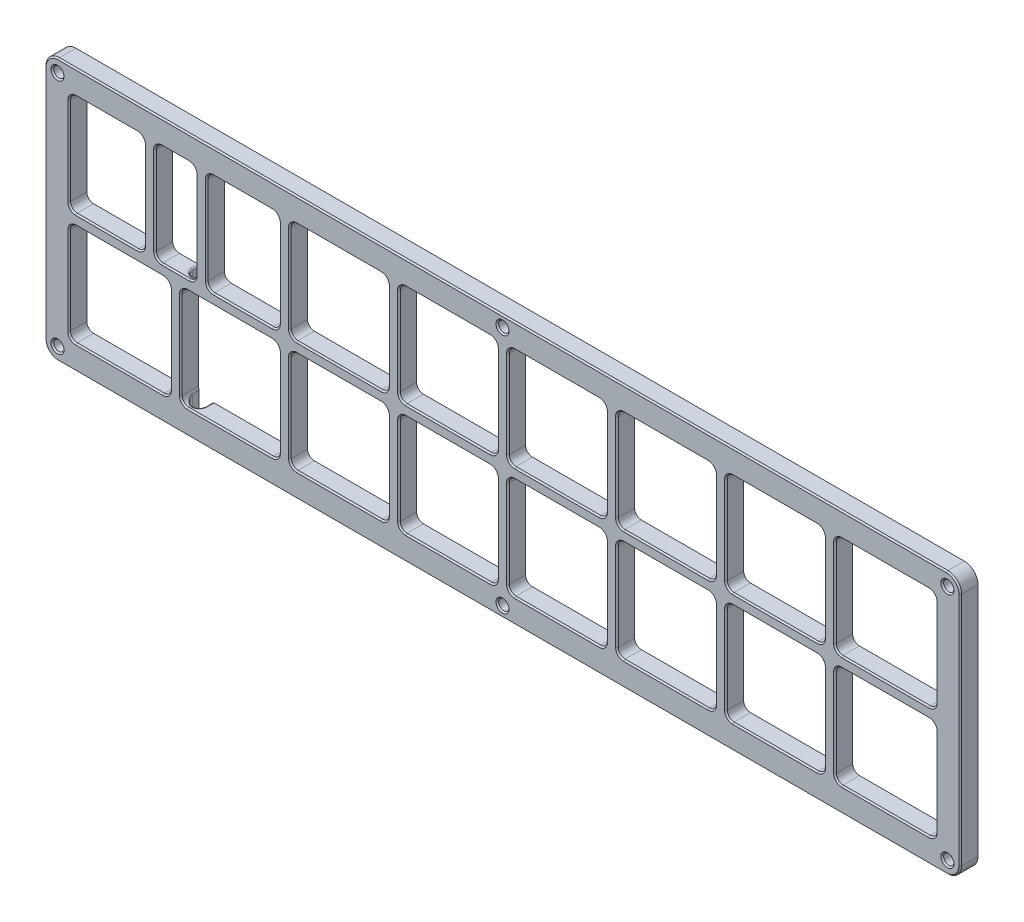
from build123d import *

# Parameters (mm, degrees)
SKETCH1_R           = 1.9
SKETCH1_W           = 37.0625
SKETCH1_H           = 37.25
SKETCH1_W_2         = 36.0625
BOSS_EXTRUDE1_DEPTH = 6.5
CUT_EXTRUDE1_REACH  = 177.152
SKETCH2_W           = 4
SKETCH2_H           = 37.25
SKETCH3_W           = 4
SKETCH3_H           = 37.25
BOSS_EXTRUDE2_DEPTH = 6.5
CUT_EXTRUDE2_REACH  = 196.068
FILLET1_R           = 2.5
FILLET2_R           = 0.5
CHAMFER1_SIZE       = 0.5


with BuildPart() as part:
    # Sketch1 → Boss-Extrude1 (new body)
    with BuildSketch(Plane.XY):
        with BuildLine():
            ThreePointArc((163.25, -48.25), (166.785533906, -46.785533906), (168.25, -43.25))
            Line((168.25, -43.25), (168.25, 43.25))
            ThreePointArc((168.25, 43.25), (166.785533906, 46.785533906), (163.25, 48.25))
            Line((163.25, 48.25), (-163.25, 48.25))
            ThreePointArc((-163.25, 48.25), (-166.785533906, 46.785533906), (-168.25, 43.25))
            Line((-168.25, 43.25), (-168.25, -43.25))
            ThreePointArc((-168.25, -43.25), (-166.785533906, -46.785533906), (-163.25, -48.25))
            Line((-163.25, -48.25), (163.25, -48.25))
        make_face()
        with Locations(Location((-163.517766953, -43.517766953, 0), (0, 0, 180))):
            Circle(SKETCH1_R, mode=Mode.SUBTRACT)
        with Locations((-140.71875, -20.625)):
            Rectangle(SKETCH1_W, SKETCH1_H, mode=Mode.SUBTRACT)
        with Locations((-100.15625, -20.625)):
            Rectangle(SKETCH1_W_2, SKETCH1_H, mode=Mode.SUBTRACT)
        with Locations((-60.09375, -20.625)):
            Rectangle(SKETCH1_W_2, SKETCH1_H, mode=Mode.SUBTRACT)
        with Locations((-20.03125, -20.625)):
            Rectangle(SKETCH1_W_2, SKETCH1_H, mode=Mode.SUBTRACT)
        with Locations(Location((0, -44.25, 0), (0, 0, 180))):
            Circle(SKETCH1_R, mode=Mode.SUBTRACT)
        with Locations(Location((163.517766953, -43.517766953, 0), (0, 0, 180))):
            Circle(SKETCH1_R, mode=Mode.SUBTRACT)
        with Locations((20.03125, -20.625)):
            Rectangle(SKETCH1_W_2, SKETCH1_H, mode=Mode.SUBTRACT)
        with Locations((60.09375, -20.625)):
            Rectangle(SKETCH1_W_2, SKETCH1_H, mode=Mode.SUBTRACT)
        with Locations((100.15625, -20.625)):
            Rectangle(SKETCH1_W_2, SKETCH1_H, mode=Mode.SUBTRACT)
        with Locations((140.71875, -20.625)):
            Rectangle(SKETCH1_W, SKETCH1_H, mode=Mode.SUBTRACT)
        with Locations((-140.71875, 20.625)):
            Rectangle(SKETCH1_W, SKETCH1_H, mode=Mode.SUBTRACT)
        with Locations((-100.15625, 20.625)):
            Rectangle(SKETCH1_W_2, SKETCH1_H, mode=Mode.SUBTRACT)
        with Locations((-60.09375, 20.625)):
            Rectangle(SKETCH1_W_2, SKETCH1_H, mode=Mode.SUBTRACT)
        with Locations((-20.03125, 20.625)):
            Rectangle(SKETCH1_W_2, SKETCH1_H, mode=Mode.SUBTRACT)
        with Locations(Location((-163.517766953, 43.517766953, 0), (0, 0, 180))):
            Circle(SKETCH1_R, mode=Mode.SUBTRACT)
        with Locations((20.03125, 20.625)):
            Rectangle(SKETCH1_W_2, SKETCH1_H, mode=Mode.SUBTRACT)
        with Locations((60.09375, 20.625)):
            Rectangle(SKETCH1_W_2, SKETCH1_H, mode=Mode.SUBTRACT)
        with Locations((100.15625, 20.625)):
            Rectangle(SKETCH1_W_2, SKETCH1_H, mode=Mode.SUBTRACT)
        with Locations((140.71875, 20.625)):
            Rectangle(SKETCH1_W, SKETCH1_H, mode=Mode.SUBTRACT)
        with Locations(Location((0, 44.25, 0), (0, 0, 180))):
            Circle(SKETCH1_R, mode=Mode.SUBTRACT)
        with Locations(Location((163.517766953, 43.517766953, 0), (0, 0, 180))):
            Circle(SKETCH1_R, mode=Mode.SUBTRACT)
    extrude(amount=BOSS_EXTRUDE1_DEPTH)

    # Sketch2 → Cut-Extrude1 (cut, up to next)
    with BuildSketch(Plane.XY.offset(6.5), mode=Mode.PRIVATE) as cut_extrude1_sk1:
        with Locations((-120.1875, 20.625)):
            Rectangle(SKETCH2_W, SKETCH2_H)
    cut_extrude1_tool1 = extrude(cut_extrude1_sk1.sketch, amount=-CUT_EXTRUDE1_REACH, mode=Mode.PRIVATE) & part.part
    add(cut_extrude1_tool1.solids().sort_by_distance((-120.1875, 20.625, 6.5))[0], mode=Mode.SUBTRACT)

    # Sketch3 → Boss-Extrude2 (add)
    with BuildSketch(Plane(origin=(0, 0, 0), x_dir=(-1, 0, 0), z_dir=(0, 0, -1))):
        with Locations((110.6875, 20.625)):
            Rectangle(SKETCH3_W, SKETCH3_H)
        with Locations((129.6875, 20.625)):
            Rectangle(SKETCH3_W, SKETCH3_H)
    extrude(amount=-BOSS_EXTRUDE2_DEPTH)

    # Cut-Extrude2: up to this face of the body (flat: up to its plane)
    cut_extrude2_end = Plane(part.part.faces().sort_by_distance((-95.40625, 2, 3.25))[0])
    # Sketch4 → Cut-Extrude2 (cut, up to the picked face)
    with BuildSketch(Plane.XZ.offset(48.25), mode=Mode.PRIVATE) as cut_extrude2_sk1:
        with BuildLine():
            Line((-117.9375, 2.5), (-117.9375, 0))
            Line((-117.9375, 0), (-112.9375, 0))
            Line((-112.9375, 0), (-112.9375, 2.5))
            ThreePointArc((-112.9375, 2.5), (-115.4375, 5), (-117.9375, 2.5))
        make_face()
    cut_extrude2_tool1 = split(extrude(cut_extrude2_sk1.sketch, amount=-CUT_EXTRUDE2_REACH, mode=Mode.PRIVATE), bisect_by=cut_extrude2_end, keep=Keep.BOTH, mode=Mode.PRIVATE)
    add(cut_extrude2_tool1.solids().sort_by(Axis((-115.4375, -48.25, 2.266625), (0, 1, 0)))[0], mode=Mode.SUBTRACT)

    # Fillet1
    fillet1_edges = [part.edges().sort_by_distance(p)[0] for p in [
        (-159.25, -2, 3.25),
        (-159.25, -39.25, 3.25),
        (-122.1875, -39.25, 3.25),
        (-38.0625, 39.25, 3.25),
        (-38.0625, 2, 3.25),
        (-2, 2, 3.25),
        (-118.1875, -2, 3.25),
        (-118.1875, -39.25, 3.25),
        (-82.125, -39.25, 3.25),
        (-78.125, 39.25, 3.25),
        (-78.125, 2, 3.25),
        (-42.0625, 2, 3.25),
        (-78.125, -2, 3.25),
        (-78.125, -39.25, 3.25),
        (-42.0625, -39.25, 3.25),
        (38.0625, 2, 3.25),
        (2, 39.25, 3.25),
        (2, 2, 3.25),
        (78.125, 2, 3.25),
        (42.0625, 2, 3.25),
        (118.1875, 2, 3.25),
        (82.125, 2, 3.25),
        (159.25, 2, 3.25),
        (122.1875, 2, 3.25),
        (122.1875, -39.25, 3.25),
        (159.25, -39.25, 3.25),
        (122.1875, -2, 3.25),
        (82.125, -39.25, 3.25),
        (118.1875, -39.25, 3.25),
        (82.125, -2, 3.25),
        (42.0625, -39.25, 3.25),
        (78.125, -39.25, 3.25),
        (42.0625, -2, 3.25),
        (2, -39.25, 3.25),
        (38.0625, -39.25, 3.25),
        (2, -2, 3.25),
        (-38.0625, -2, 3.25),
        (-38.0625, -39.25, 3.25),
        (-2, -39.25, 3.25),
        (-159.25, 39.25, 3.25),
        (-159.25, 2, 3.25),
        (-131.6875, 2, 3.25),
        (-127.6875, 2, 3.25),
        (-112.6875, 2, 3.25),
        (-127.6875, 39.25, 3.25),
        (-108.6875, 2, 3.25),
        (-82.125, 2, 3.25),
        (-108.6875, 39.25, 3.25),
        (42.0625, 39.25, 3.25),
        (82.125, 39.25, 3.25),
        (122.1875, 39.25, 3.25),
        (-122.1875, -2, 3.25),
        (-82.125, -2, 3.25),
        (-42.0625, -2, 3.25),
        (-2, -2, 3.25),
        (38.0625, -2, 3.25),
        (78.125, -2, 3.25),
        (118.1875, -2, 3.25),
        (159.25, -2, 3.25),
        (-131.6875, 39.25, 3.25),
        (-112.6875, 39.25, 3.25),
        (-82.125, 39.25, 3.25),
        (-42.0625, 39.25, 3.25),
        (-2, 39.25, 3.25),
        (38.0625, 39.25, 3.25),
        (78.125, 39.25, 3.25),
        (118.1875, 39.25, 3.25),
        (159.25, 39.25, 3.25),
    ]]
    fillet(fillet1_edges, radius=FILLET1_R)

    # Fillet2
    fillet2_edges = [part.edges().sort_by_distance(p)[0] for p in [
        (-113.557922775, 2.604089117, 4.148389964),
        (-112.9375, 3.410275264, 1.25),
        (-113.760449017, -2, 4.354049622),
        (-112.9375, -2, 1.25),
        (-113.760449017, -39.25, 4.354049622),
        (-112.9375, -39.25, 1.25),
        (-115.4375, -48.25, 5),
        (-117.9375, -48.25, 1.25),
        (-112.9375, -48.25, 1.25),
        (-117.114550983, 2, 4.354049622),
        (-117.9375, 2, 1.25),
        (-117.317077229, -2.604089118, 4.148389967),
        (-117.9375, -3.410275264, 1.25),
        (-117.9375, -37.839724736, 1.25),
        (-117.317077229, -38.645910882, 4.148389967),
    ]]
    fillet(fillet2_edges, radius=FILLET2_R)

    # Chamfer1
    chamfer1_edges = [part.edges().sort_by_distance(p)[0] for p in [
        (-132.419733047, 2.732233047, 6.5),
        (-126.955266953, 2.732233047, 6.5),
        (-113.419733047, 2.732233047, 6.5),
        (-126.955266953, 38.517766953, 6.5),
        (-107.955266953, 2.732233047, 6.5),
        (-82.857233047, 2.732233047, 6.5),
        (-107.955266953, 38.517766953, 6.5),
        (42.794733047, 38.517766953, 6.5),
        (82.857233047, 38.517766953, 6.5),
        (122.919733047, 38.517766953, 6.5),
        (-122.919733047, -2.732233047, 6.5),
        (-82.857233047, -2.732233047, 6.5),
        (-42.794733047, -2.732233047, 6.5),
        (-2.732233047, -2.732233047, 6.5),
        (37.330266953, -2.732233047, 6.5),
        (77.392766953, -2.732233047, 6.5),
        (117.455266953, -2.732233047, 6.5),
        (158.517766953, -2.732233047, 6.5),
        (-132.419733047, 38.517766953, 6.5),
        (-113.419733047, 38.517766953, 6.5),
        (-82.857233047, 38.517766953, 6.5),
        (-42.794733047, 38.517766953, 6.5),
        (-2.732233047, 38.517766953, 6.5),
        (37.330266953, 38.517766953, 6.5),
        (77.392766953, 38.517766953, 6.5),
        (117.455266953, 38.517766953, 6.5),
        (158.517766953, 38.517766953, 6.5),
        (-161.617766953, -43.517766953, 6.5),
        (1.9, -44.25, 6.5),
        (165.417766953, -43.517766953, 6.5),
        (165.417766953, 43.517766953, 6.5),
        (1.9, 44.25, 6.5),
        (-161.617766953, 43.517766953, 6.5),
        (-168.25, 0, 6.5),
        (-166.785533906, -46.785533906, 6.5),
        (0, -48.25, 6.5),
        (166.785533906, -46.785533906, 6.5),
        (168.25, 0, 6.5),
        (166.785533906, 46.785533906, 6.5),
        (0, 48.25, 6.5),
        (-166.785533906, 46.785533906, 6.5),
        (-140.71875, -2, 6.5),
        (-159.25, -20.625, 6.5),
        (-140.71875, -39.25, 6.5),
        (-122.1875, -20.625, 6.5),
        (-20.03125, 39.25, 6.5),
        (-38.0625, 20.625, 6.5),
        (-20.03125, 2, 6.5),
        (-2, 20.625, 6.5),
        (-100.15625, -2, 6.5),
        (-118.1875, -20.625, 6.5),
        (-100.15625, -39.25, 6.5),
        (-82.125, -20.625, 6.5),
        (-60.09375, 39.25, 6.5),
        (-78.125, 20.625, 6.5),
        (-60.09375, 2, 6.5),
        (-42.0625, 20.625, 6.5),
        (-60.09375, -2, 6.5),
        (-78.125, -20.625, 6.5),
        (-60.09375, -39.25, 6.5),
        (-42.0625, -20.625, 6.5),
        (20.03125, 2, 6.5),
        (38.0625, 20.625, 6.5),
        (20.03125, 39.25, 6.5),
        (2, 20.625, 6.5),
        (60.09375, 2, 6.5),
        (78.125, 20.625, 6.5),
        (42.0625, 20.625, 6.5),
        (100.15625, 2, 6.5),
        (118.1875, 20.625, 6.5),
        (82.125, 20.625, 6.5),
        (140.71875, 2, 6.5),
        (159.25, 20.625, 6.5),
        (122.1875, 20.625, 6.5),
        (122.1875, -20.625, 6.5),
        (140.71875, -39.25, 6.5),
        (159.25, -20.625, 6.5),
        (140.71875, -2, 6.5),
        (82.125, -20.625, 6.5),
        (100.15625, -39.25, 6.5),
        (118.1875, -20.625, 6.5),
        (100.15625, -2, 6.5),
        (42.0625, -20.625, 6.5),
        (60.09375, -39.25, 6.5),
        (78.125, -20.625, 6.5),
        (60.09375, -2, 6.5),
        (2, -20.625, 6.5),
        (20.03125, -39.25, 6.5),
        (38.0625, -20.625, 6.5),
        (20.03125, -2, 6.5),
        (-20.03125, -2, 6.5),
        (-38.0625, -20.625, 6.5),
        (-20.03125, -39.25, 6.5),
        (-2, -20.625, 6.5),
        (-145.46875, 39.25, 6.5),
        (-159.25, 20.625, 6.5),
        (-145.46875, 2, 6.5),
        (-131.6875, 20.625, 6.5),
        (-127.6875, 20.625, 6.5),
        (-120.1875, 2, 6.5),
        (-112.6875, 20.625, 6.5),
        (-120.1875, 39.25, 6.5),
        (-108.6875, 20.625, 6.5),
        (-95.40625, 2, 6.5),
        (-82.125, 20.625, 6.5),
        (-95.40625, 39.25, 6.5),
        (60.09375, 39.25, 6.5),
        (100.15625, 39.25, 6.5),
        (140.71875, 39.25, 6.5),
        (-158.517766953, -2.732233047, 6.5),
        (-158.517766953, -38.517766953, 6.5),
        (-122.919733047, -38.517766953, 6.5),
        (-37.330266953, 38.517766953, 6.5),
        (-37.330266953, 2.732233047, 6.5),
        (-2.732233047, 2.732233047, 6.5),
        (-117.455266953, -2.732233047, 6.5),
        (-117.455266953, -38.517766953, 6.5),
        (-82.857233047, -38.517766953, 6.5),
        (-77.392766953, 38.517766953, 6.5),
        (-77.392766953, 2.732233047, 6.5),
        (-42.794733047, 2.732233047, 6.5),
        (-77.392766953, -2.732233047, 6.5),
        (-77.392766953, -38.517766953, 6.5),
        (-42.794733047, -38.517766953, 6.5),
        (37.330266953, 2.732233047, 6.5),
        (2.732233047, 38.517766953, 6.5),
        (2.732233047, 2.732233047, 6.5),
        (77.392766953, 2.732233047, 6.5),
        (42.794733047, 2.732233047, 6.5),
        (117.455266953, 2.732233047, 6.5),
        (82.857233047, 2.732233047, 6.5),
        (158.517766953, 2.732233047, 6.5),
        (122.919733047, 2.732233047, 6.5),
        (122.919733047, -38.517766953, 6.5),
        (158.517766953, -38.517766953, 6.5),
        (122.919733047, -2.732233047, 6.5),
        (82.857233047, -38.517766953, 6.5),
        (117.455266953, -38.517766953, 6.5),
        (82.857233047, -2.732233047, 6.5),
        (42.794733047, -38.517766953, 6.5),
        (77.392766953, -38.517766953, 6.5),
        (42.794733047, -2.732233047, 6.5),
        (-161.617766953, 43.517766953, 0),
        (2.732233047, -38.517766953, 6.5),
        (1.9, 44.25, 0),
        (37.330266953, -38.517766953, 6.5),
        (165.417766953, 43.517766953, 0),
        (165.417766953, -43.517766953, 0),
        (2.732233047, -2.732233047, 6.5),
        (1.9, -44.25, 0),
        (-161.617766953, -43.517766953, 0),
        (-37.330266953, -2.732233047, 6.5),
        (-37.330266953, -38.517766953, 6.5),
        (-2.732233047, -38.517766953, 6.5),
        (-158.517766953, 38.517766953, 6.5),
        (-158.517766953, 2.732233047, 6.5),
    ]]
    chamfer(chamfer1_edges, length=CHAMFER1_SIZE)


solid = part.part
